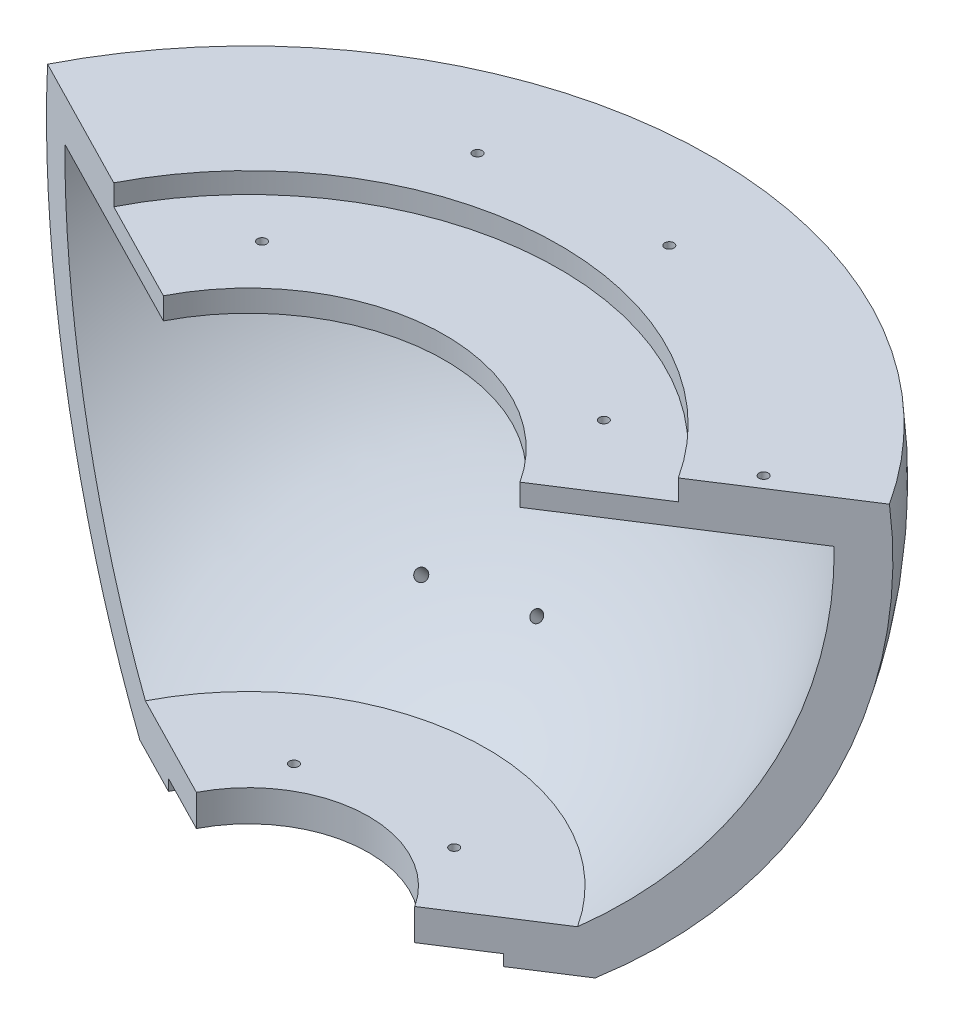
from build123d import *

# Parameters (mm, degrees)
ENL_V_MAT_EXTRU_1_DEPTH  = 205
ESQUISSE4_W              = 219.421497641
ESQUISSE4_H              = 186.787380576
ENL_V_MAT_EXTRU_2_DEPTH  = 241.082722882
COQUE2_T                 = -10
ENL_V_MAT_EXTRU_4_DEPTH  = 5
ENL_V_MAT_EXTRU_5_DEPTH  = 25
ENL_V_MAT_EXTRU_6_DEPTH  = 2.5
ENL_V_MAT_EXTRU_10_DEPTH = 15
ECHELLE1_SCALE           = 1.15
TROU_TARAUD_M32_D        = 2.5
TROU_TARAUD_M32_DEPTH    = 12.5
TROU_TARAUD_M32_TIP      = 0.751075774
TROU_TARAUD_M33_D        = 2.5
TROU_TARAUD_M33_DEPTH    = 12.5
TROU_TARAUD_M33_TIP      = 0.751075774
TROU_TARAUD_M35_D        = 2.5
TROU_TARAUD_M35_DEPTH    = 12.5
TROU_TARAUD_M35_TIP      = 0.751075774
ESQUISSE23_R             = 1.5
ENL_V_MAT_EXTRU_11_DEPTH = 40


with BuildPart() as part:
    # Esquisse1 → Révolution2 (revolve)
    with BuildSketch(Plane.XY):
        with BuildLine():
            Line((0.334149559, -92.625367455), (0.334149559, 171))
            ThreePointArc((0.334149559, 171), (43.341663836, 173.345331392), (83, 190.148998741))
            ThreePointArc((83, 190.148998741), (97.133928161, 161.990328143), (102, 130.86156331))
            add(Edge.make_bspline(
                [(102, 130.86156331), (103.479009077, 113.684745488), (71.205293421, 65.560678141), (110.707376512, 34.252457406), (109.358599643, 11.86156331)],
                knots=[0, 0, 0, 0, 0.406612523, 1, 1, 1, 1], degree=3))
            ThreePointArc((109.358599643, 11.86156331), (99.215374733, -47.500625433), (59.334149559, -92.625367455))
            Line((59.334149559, -92.625367455), (0.334149559, -92.625367455))
        make_face()
    revolve(axis=Axis((0.334149559, -92.625367455, 0), (0, 1, 0)))

    # Esquisse3 → Enlèv. mat.-Extru.1 (cut, symmetric)
    with BuildSketch(Plane(origin=(0, 0, 0), x_dir=(1, 0, 0), z_dir=(0, 1, 0))):
        with BuildLine():
            Line((-97.244399695, 50.050229554), (0.334149559, 0))
            Line((0.334149559, 0), (92.468194445, 59.480387742))
            ThreePointArc((92.468194445, 59.480387742), (5.778653928, -109.530617295), (-97.244399695, 50.050229554))
        make_face()
    extrude(amount=ENL_V_MAT_EXTRU_1_DEPTH, both=True, mode=Mode.SUBTRACT)

    # Esquisse4 → Enlèv. mat.-Extru.2 (cut, through all)
    with BuildSketch(Plane.XY):
        with Locations((-2.038050308, 104.768322833)):
            Rectangle(ESQUISSE4_W, ESQUISSE4_H)
    extrude(amount=-ENL_V_MAT_EXTRU_2_DEPTH, mode=Mode.SUBTRACT)

    # Coque2
    coque2_openings = [part.faces().sort_by_distance(p)[0] for p in [
        (41.688799169, -36.484898267, -26.697955102),
        (-43.464282683, -36.484897866, -22.465199622),
    ]]
    offset(amount=COQUE2_T, openings=coque2_openings, kind=Kind.INTERSECTION)

    # Esquisse6 → Enlèv. mat.-Extru.4 (cut)
    with BuildSketch(Plane(origin=(0, 11.5, 0), x_dir=(1, 0, 0), z_dir=(0, 1, 0))):
        with BuildLine():
            Line((-64.751451353, 33.383866548), (0.334149559, 0))
            Line((0.334149559, 0), (61.788226523, 39.673850536))
            ThreePointArc((61.788226523, 39.673850536), (-3.29737439, 73.057717085), (-64.751451353, 33.383866548))
        make_face()
    extrude(amount=-ENL_V_MAT_EXTRU_4_DEPTH, mode=Mode.SUBTRACT)

    # Esquisse7 → Enlèv. mat.-Extru.5 (cut)
    with BuildSketch(Plane(origin=(0, 11.5, 0), x_dir=(1, 0, 0), z_dir=(0, 1, 0))):
        with BuildLine():
            Line((-40.77485255, 21.085730501), (0.334149559, 0))
            Line((0.334149559, 0), (39.149428885, 25.0585749))
            ThreePointArc((39.149428885, 25.0585749), (-1.959573224, 46.144305401), (-40.77485255, 21.085730501))
        make_face()
    extrude(amount=-ENL_V_MAT_EXTRU_5_DEPTH, mode=Mode.SUBTRACT)

    # Esquisse8 → Enlèv. mat.-Extru.6 (cut, symmetric)
    with BuildSketch(Plane(origin=(0, -92.5, 0), x_dir=(1, 0, 0), z_dir=(0, 1, 0))):
        with BuildLine():
            Line((36.828161908, 23.559998993), (0.334149559, 0))
            Line((0.334149559, 0), (-38.316414256, 19.824742283))
            ThreePointArc((-38.316414256, 19.824742283), (-1.822401908, 43.384741276), (36.828161908, 23.559998993))
        make_face()
    extrude(amount=ENL_V_MAT_EXTRU_6_DEPTH, both=True, mode=Mode.SUBTRACT)

    # Esquisse10 → Enlèv. mat.-Extru.10 (cut)
    with BuildSketch(Plane(origin=(0, -92.5, 0), x_dir=(1, 0, 0), z_dir=(0, 1, 0))):
        with BuildLine():
            Line((-24.838107184, 12.911415859), (0.334149559, 0))
            Line((0.334149559, 0), (24.101892064, 15.344105881))
            ThreePointArc((24.101892064, 15.344105881), (-1.070364679, 28.25552174), (-24.838107184, 12.911415859))
        make_face()
    extrude(amount=ENL_V_MAT_EXTRU_10_DEPTH, mode=Mode.SUBTRACT)


with BuildPart() as part_1:
    # Echelle1: scaled about (-3.205196898, -32.62107135, -71.203315854)
    add(part.part.scale(ECHELLE1_SCALE).moved(Location((0.480779535, 4.893160702, 10.680497378))))

    # Trou taraudé M32
    with Locations(Plane(origin=(-21.564432755, -98.60683867, -24.05170562), x_dir=(0, 0, -1), z_dir=(0, -1, 0))):
        with Locations((0, 0), (2.053122984, 41.304003571)):
            Hole(TROU_TARAUD_M32_D / 2, depth=TROU_TARAUD_M32_DEPTH)
            with Locations((0, 0, -(TROU_TARAUD_M32_DEPTH + TROU_TARAUD_M32_TIP / 2))):  # 118° drill point
                Cone(0, TROU_TARAUD_M32_D / 2, TROU_TARAUD_M32_TIP, mode=Mode.SUBTRACT)

    # Trou taraudé M33
    with Locations(Plane(origin=(-45.802285112, 12.36816133, -39.635090601), x_dir=(0, 0, 1), z_dir=(0, 1, 0))):
        with Locations((0, 0), (-4.379976461, 88.114820569)):
            Hole(TROU_TARAUD_M33_D / 2, depth=TROU_TARAUD_M33_DEPTH)
            with Locations((0, 0, -(TROU_TARAUD_M33_DEPTH + TROU_TARAUD_M33_TIP / 2))):  # 118° drill point
                Cone(0, TROU_TARAUD_M33_D / 2, TROU_TARAUD_M33_TIP, mode=Mode.SUBTRACT)

    # Trou taraudé M35
    with Locations(Plane(origin=(82.53934023, 17.973988757, -47.019680031), x_dir=(1, 0, 0), z_dir=(0, 1, 0))):
        with Locations((0, 0), (-66.69965831, 41.172267137), (-114.254701281, 36.84355094)):
            Hole(TROU_TARAUD_M35_D / 2, depth=TROU_TARAUD_M35_DEPTH)
            with Locations((0, 0, -(TROU_TARAUD_M35_DEPTH + TROU_TARAUD_M35_TIP / 2))):  # 118° drill point
                Cone(0, TROU_TARAUD_M35_D / 2, TROU_TARAUD_M35_TIP, mode=Mode.SUBTRACT)

    # Esquisse23 → Enlèv. mat.-Extru.11 (cut)
    with BuildSketch(Plane(origin=(-19.273619273, -89.804688212, -82.066838873), x_dir=(-0.9876815415012294, 0.1155106334721785, 0.10555788048559506), z_dir=(-0.15647738679360396, -0.7291003694870504, -0.6662788294971496))):
        with Locations(Location((-10.604108873, 5.618400934, 0), (0, 0, 3.1152173))):
            Circle(ESQUISSE23_R)
        with Locations(Location((15.022911638, 1.230255574, 0), (0, 0, 2.971685795))):
            Circle(ESQUISSE23_R)
    extrude(amount=-ENL_V_MAT_EXTRU_11_DEPTH, mode=Mode.SUBTRACT)


solid = part_1.part
